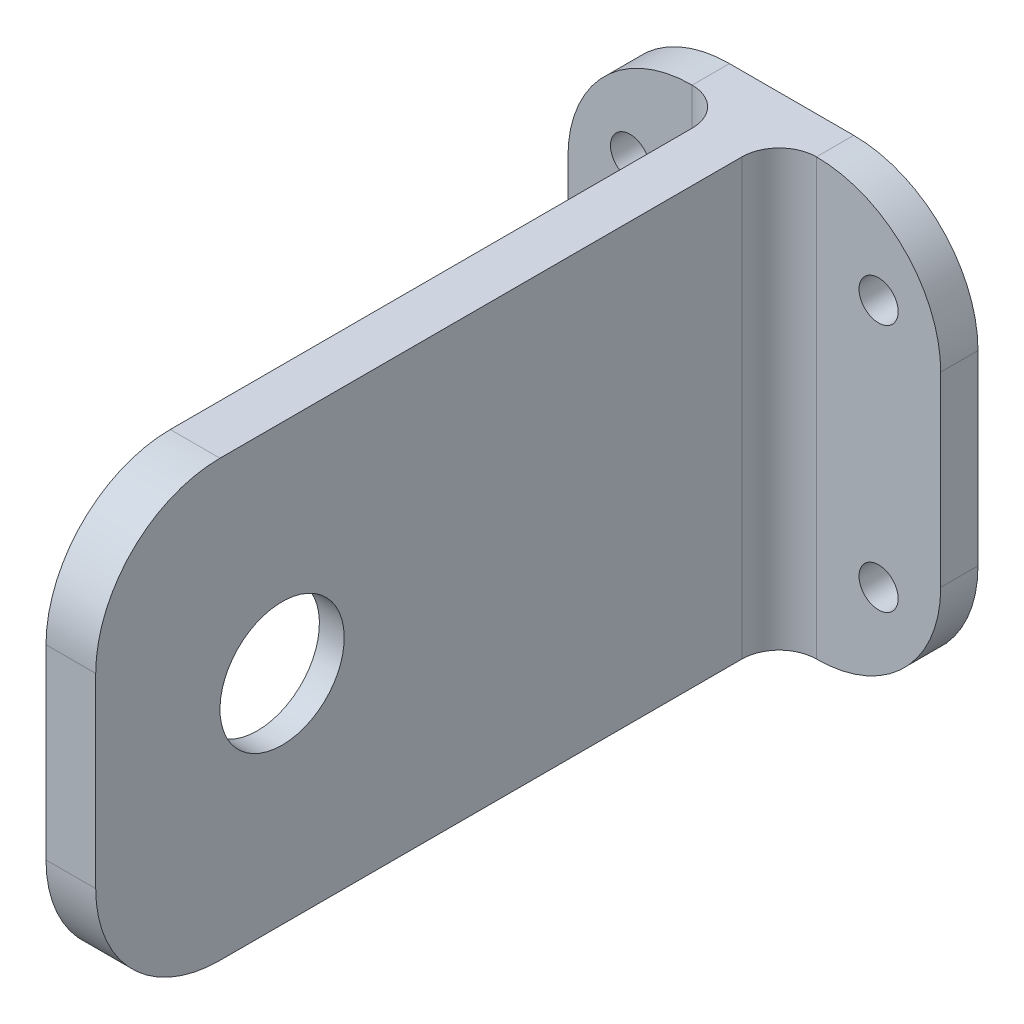
from build123d import *

# Parameters (mm, degrees)
SKETCH1_W           = 30
SKETCH1_H           = 35
BOSS_EXTRUDE2_DEPTH = 3
SKETCH3_W           = 4
SKETCH3_H           = 35
BOSS_EXTRUDE3_DEPTH = 55
SKETCH4_R           = 1.575
CUT_EXTRUDE2_DEPTH  = 55
FILLET1_R           = 10
SKETCH5_R           = 11
CUT_EXTRUDE3_DEPTH  = 2
SKETCH6_R           = 5
CUT_EXTRUDE4_DEPTH  = 2
FILLET2_R           = 3


with BuildPart() as part:
    # Sketch1 → Boss-Extrude2 (new body)
    with BuildSketch(Plane.XY):
        Rectangle(SKETCH1_W, SKETCH1_H)
    extrude(amount=BOSS_EXTRUDE2_DEPTH)

    # Sketch3 → Boss-Extrude3 (add)
    with BuildSketch(Plane.XY.offset(3)):
        Rectangle(SKETCH3_W, SKETCH3_H)
    extrude(amount=BOSS_EXTRUDE3_DEPTH)

    # Sketch4 → Cut-Extrude2 (cut)
    with BuildSketch(Plane.XY.offset(3)):
        with Locations((10, 10)):
            Circle(SKETCH4_R)
        with Locations((10, -10)):
            Circle(SKETCH4_R)
        with Locations((-10, -10)):
            Circle(SKETCH4_R)
        with Locations((-10, 10)):
            Circle(SKETCH4_R)
    extrude(amount=-CUT_EXTRUDE2_DEPTH, mode=Mode.SUBTRACT)

    # Fillet1
    fillet1_edges = [part.edges().sort_by_distance(p)[0] for p in [
        (0, 17.5, 58),
        (0, -17.5, 58),
        (15, -17.5, 1.5),
        (-15, -17.5, 1.5),
        (-15, 17.5, 1.5),
        (15, 17.5, 1.5),
    ]]
    fillet(fillet1_edges, radius=FILLET1_R)

    # Sketch5 → Cut-Extrude3 (cut)
    with BuildSketch(Plane.ZY.offset(2)):
        with Locations(Location((43, 0, 0), (0, 0, 270))):
            Circle(SKETCH5_R)
    extrude(amount=-CUT_EXTRUDE3_DEPTH, mode=Mode.SUBTRACT)

    # Sketch6 → Cut-Extrude4 (cut)
    with BuildSketch(Plane.ZY):
        with Locations(Location((43, 0, 0), (0, 0, 270))):
            Circle(SKETCH6_R)
    extrude(amount=-CUT_EXTRUDE4_DEPTH, mode=Mode.SUBTRACT)

    # Fillet2
    fillet2_edges = [part.edges().sort_by_distance(p)[0] for p in [
        (2, 0, 3),
        (-2, 0, 3),
    ]]
    fillet(fillet2_edges, radius=FILLET2_R)


solid = part.part
